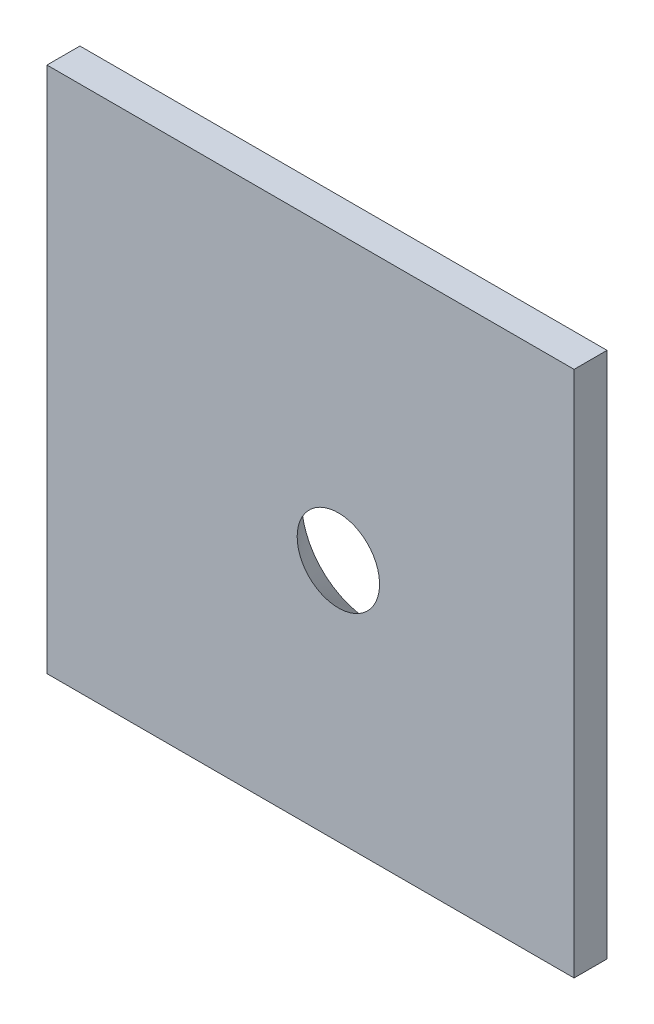
from build123d import *

# Parameters (mm, degrees)
SKETCH1_W           = 50.8
SKETCH1_H           = 50.8
BOSS_EXTRUDE2_DEPTH = 3.175


with BuildPart() as part:
    # Sketch1 → Boss-Extrude2 (new body)
    with BuildSketch(Plane.XY):
        with Locations((25.4, -25.4)):
            Rectangle(SKETCH1_W, SKETCH1_H)
    extrude(amount=BOSS_EXTRUDE2_DEPTH)

    # Sketch2 → 1/4 (0.25) Diameter Hole1 (revolve, cut)
    with BuildSketch(Plane(origin=(28.083631343, -27.305207035, 0), x_dir=(0, 1, 0), z_dir=(1, 0, 0))):
        Polygon((0, 0), (0, 3.175), (3.175, 3.175), (3.175, 4.090710056), (6.731, 0), align=None)
    revolve(axis=Axis((28.083631343, -27.305207035, -6.35), (0, 0, 1)), mode=Mode.SUBTRACT)


solid = part.part
